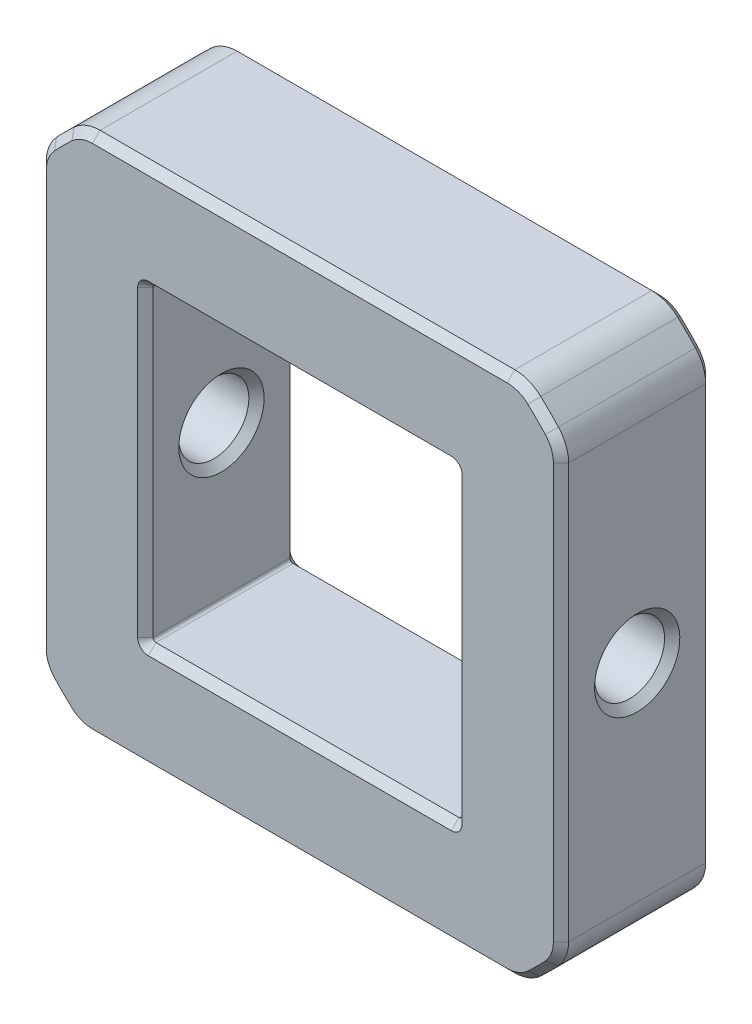
from build123d import *

# Parameters (mm, degrees)
SKIZZE1_W                       = 20.3
SKIZZE1_H                       = 20.3
AUFSATZ_LINEAR_AUSTRAGEN1_DEPTH = 10
VERRUNDUNG1_R                   = 0.2
VERRUNDUNG2_R                   = 2.5
SKIZZE2_R                       = 2.3
SCHNITT_LINEAR_AUSTRAGEN1_DEPTH = 40.630953811
FASE2_SIZE                      = 0.5


with BuildPart() as part:
    # Skizze1 → Aufsatz-Linear austragen1 (new body)
    with BuildSketch(Plane.XY):
        with BuildLine():
            Line((14.564597488, 17.15), (-14.564597488, 17.15))
            ThreePointArc((-14.564597488, 17.15), (-15.909902577, 15.909902577), (-17.15, 14.564597488))
            Line((-17.15, 14.564597488), (-17.15, -14.564597488))
            ThreePointArc((-17.15, -14.564597488), (-15.909902577, -15.909902577), (-14.564597488, -17.15))
            Line((-14.564597488, -17.15), (14.564597488, -17.15))
            ThreePointArc((14.564597488, -17.15), (15.909902577, -15.909902577), (17.15, -14.564597488))
            Line((17.15, -14.564597488), (17.15, 14.564597488))
            ThreePointArc((17.15, 14.564597488), (15.909902577, 15.909902577), (14.564597488, 17.15))
        make_face()
        Rectangle(SKIZZE1_W, SKIZZE1_H, mode=Mode.SUBTRACT)
    extrude(amount=AUFSATZ_LINEAR_AUSTRAGEN1_DEPTH)

    # Verrundung1
    verrundung1_edges = [part.edges().sort_by_distance(p)[0] for p in [
        (10.15, -10.15, 5),
        (10.15, 10.15, 5),
        (-10.15, 10.15, 5),
        (-10.15, -10.15, 5),
    ]]
    fillet(verrundung1_edges, radius=VERRUNDUNG1_R)

    # Verrundung2
    verrundung2_edges = [part.edges().sort_by_distance(p)[0] for p in [
        (17.15, 14.564597488, 5),
        (17.15, -14.564597488, 5),
        (14.564597488, -17.15, 5),
        (-14.564597488, -17.15, 5),
        (-17.15, -14.564597488, 5),
        (-17.15, 14.564597488, 5),
        (-14.564597488, 17.15, 5),
        (14.564597488, 17.15, 5),
    ]]
    fillet(verrundung2_edges, radius=VERRUNDUNG2_R)

    # Skizze2 → Schnitt-Linear austragen1 (cut, through all)
    with BuildSketch(Plane(origin=(17.15, 0, 0), x_dir=(0, 0, -1), z_dir=(1, 0, 0))):
        with Locations(Location((-5, 0, 0), (0, 0, 90))):
            Circle(SKIZZE2_R)
    extrude(amount=-SCHNITT_LINEAR_AUSTRAGEN1_DEPTH, mode=Mode.SUBTRACT)

    # Fase2
    fase2_edges = [part.edges().sort_by_distance(p)[0] for p in [
        (-10.15, -2.3, 5),
        (10.15, -2.3, 5),
        (-17.15, -2.3, 5),
        (17.15, -2.3, 5),
        (0, -10.15, 0),
        (0, -10.15, 10),
        (10.15, 0, 0),
        (10.15, 0, 10),
        (-10.15, 0, 0),
        (-10.15, 0, 10),
        (0, 10.15, 0),
        (0, 10.15, 10),
        (10.091421356, -10.091421356, 0),
        (10.091421356, -10.091421356, 10),
        (-10.091421356, -10.091421356, 0),
        (-10.091421356, -10.091421356, 10),
        (-10.091421356, 10.091421356, 0),
        (-10.091421356, 10.091421356, 10),
        (10.091421356, 10.091421356, 0),
        (10.091421356, 10.091421356, 10),
        (0, 17.15, 0),
        (0, 17.15, 10),
        (15.909902577, 15.909902577, 0),
        (17.15, 0, 0),
        (15.909902577, -15.909902577, 0),
        (0, -17.15, 0),
        (-15.909902577, -15.909902577, 0),
        (-17.15, 0, 0),
        (-15.909902577, 15.909902577, 0),
        (-14.52963679, 16.976813809, 0),
        (-16.976813809, 14.52963679, 0),
        (-16.976813809, -14.52963679, 0),
        (-14.52963679, -16.976813809, 0),
        (14.52963679, -16.976813809, 0),
        (16.976813809, -14.52963679, 0),
        (16.976813809, 14.52963679, 0),
        (14.52963679, 16.976813809, 0),
        (15.909902577, 15.909902577, 10),
        (-15.909902577, 15.909902577, 10),
        (-17.15, 0, 10),
        (-15.909902577, -15.909902577, 10),
        (0, -17.15, 10),
        (15.909902577, -15.909902577, 10),
        (17.15, 0, 10),
        (-14.52963679, 16.976813809, 10),
        (-16.976813809, 14.52963679, 10),
        (-16.976813809, -14.52963679, 10),
        (-14.52963679, -16.976813809, 10),
        (14.52963679, -16.976813809, 10),
        (16.976813809, -14.52963679, 10),
        (16.976813809, 14.52963679, 10),
        (14.52963679, 16.976813809, 10),
    ]]
    chamfer(fase2_edges, length=FASE2_SIZE)


solid = part.part
